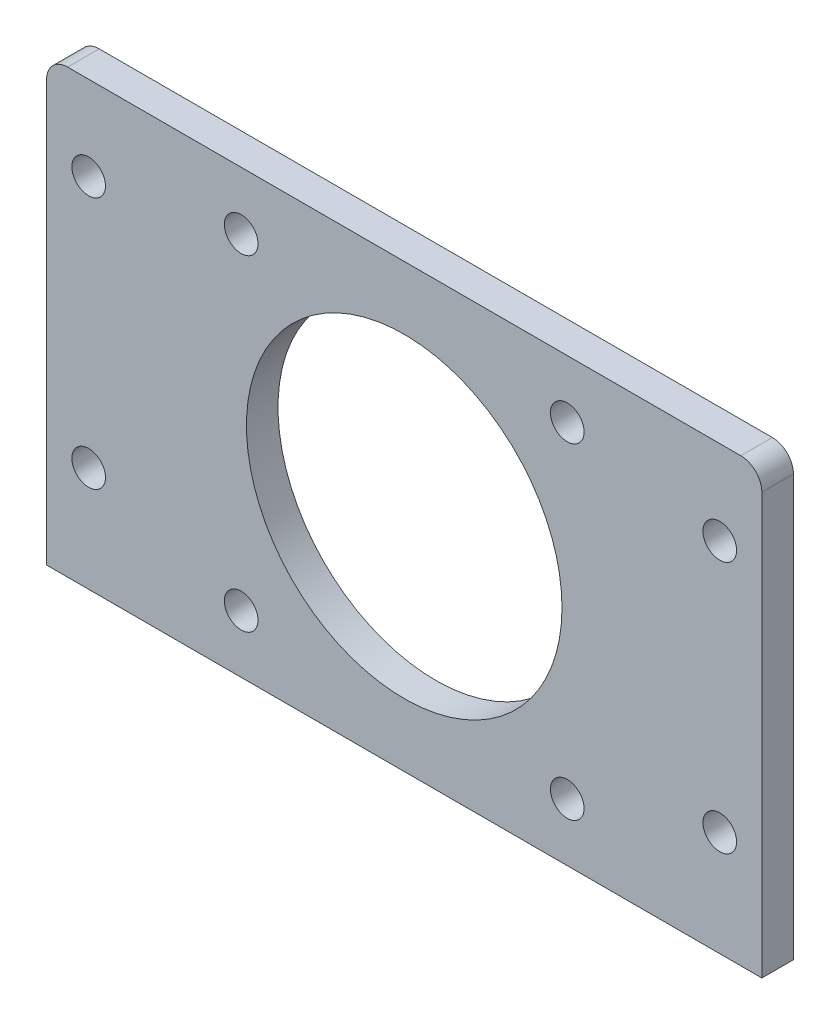
from build123d import *

# Parameters (mm, degrees)
SKETCH_1_R      = 1.6
SKETCH_1_R_2    = 15
EXTRUDE_1_DEPTH = 3


with BuildPart() as part:
    # 草图1 → 凸台-拉伸1 (new body)
    with BuildSketch(Plane.XY):
        with BuildLine():
            Line((-34, 0), (34, 0))
            Line((34, 0), (34, 40))
            ThreePointArc((34, 40), (33.414213562, 41.414213562), (32, 42))
            Line((32, 42), (-32, 42))
            ThreePointArc((-32, 42), (-33.414213562, 41.414213562), (-34, 40))
            Line((-34, 40), (-34, 0))
        make_face()
        with Locations((15.5, 5.5)):
            Circle(SKETCH_1_R, mode=Mode.SUBTRACT)
        with Locations((-15.5, 5.5)):
            Circle(SKETCH_1_R, mode=Mode.SUBTRACT)
        with Locations((-15.5, 36.5)):
            Circle(SKETCH_1_R, mode=Mode.SUBTRACT)
        with Locations((15.5, 36.5)):
            Circle(SKETCH_1_R, mode=Mode.SUBTRACT)
        with Locations((30, 34)):
            Circle(SKETCH_1_R, mode=Mode.SUBTRACT)
        with Locations((30, 10)):
            Circle(SKETCH_1_R, mode=Mode.SUBTRACT)
        with Locations((-30, 10)):
            Circle(SKETCH_1_R, mode=Mode.SUBTRACT)
        with Locations((-30, 34)):
            Circle(SKETCH_1_R, mode=Mode.SUBTRACT)
        with Locations((0, 21)):
            Circle(SKETCH_1_R_2, mode=Mode.SUBTRACT)
    extrude(amount=EXTRUDE_1_DEPTH)


solid = part.part
